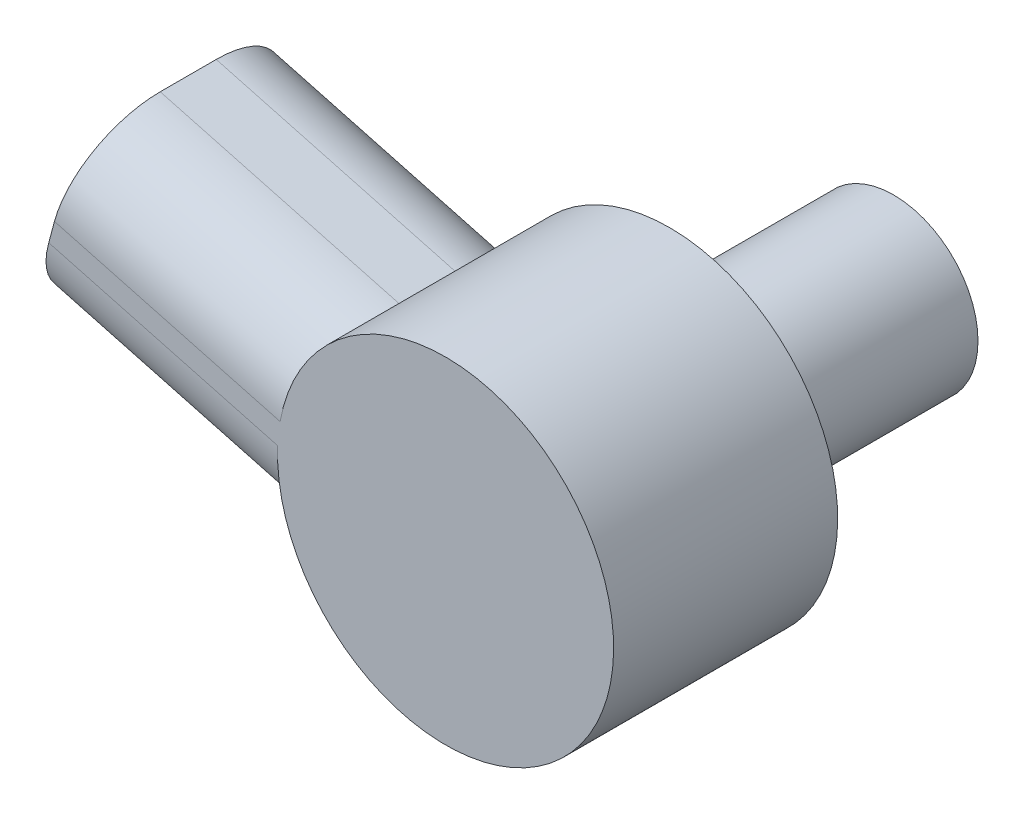
from build123d import *

# Parameters (mm, degrees)
BOSS_EXTRUDE1_DEPTH = 40
SKETCH2_R           = 15.05
CUT_EXTRUDE1_DEPTH  = 40
FILLET1_R           = 15
SKETCH3_R           = 15.05
BOSS_EXTRUDE2_DEPTH = 40


with BuildPart() as part:
    # Sketch1 → Boss-Extrude1 (new body)
    with BuildSketch(Plane.XY):
        with BuildLine():
            Line((-23.162738789, 19.065348982), (-65.942835362, 30.52824131))
            Line((-65.942835362, 30.52824131), (-74.725635473, -2.249614938))
            Line((-74.725635473, -2.249614938), (-25.7643439, -15.368753476))
            ThreePointArc((-25.7643439, -15.368753476), (29.91474065, -2.260153064), (-23.162738789, 19.065348982))
        make_face()
    extrude(amount=BOSS_EXTRUDE1_DEPTH)

    # Sketch2 → Cut-Extrude1 (cut)
    with BuildSketch(Plane(origin=(-69.157563319, 18.530713242, 0), x_dir=(0, 0, 1), z_dir=(-0.9659258262890691, 0.2588190451025179, 0))):
        with Locations((20, -4.546311876)):
            Circle(SKETCH2_R)
    extrude(amount=-CUT_EXTRUDE1_DEPTH, mode=Mode.SUBTRACT)

    # Fillet1
    fillet1_edges = [part.edges().sort_by_distance(p)[0] for p in [
        (-50.244989687, -8.809184207, 0),
        (-50.244989687, -8.809184207, 40),
        (-44.552787075, 24.796795146, 0),
        (-44.552787075, 24.796795146, 40),
    ]]
    fillet(fillet1_edges, radius=FILLET1_R)

    # Sketch3 → Boss-Extrude2 (add)
    with BuildSketch(Plane(origin=(0, 0, 0), x_dir=(-1, 0, 0), z_dir=(0, 0, -1))):
        Circle(SKETCH3_R)
    extrude(amount=BOSS_EXTRUDE2_DEPTH)


solid = part.part
